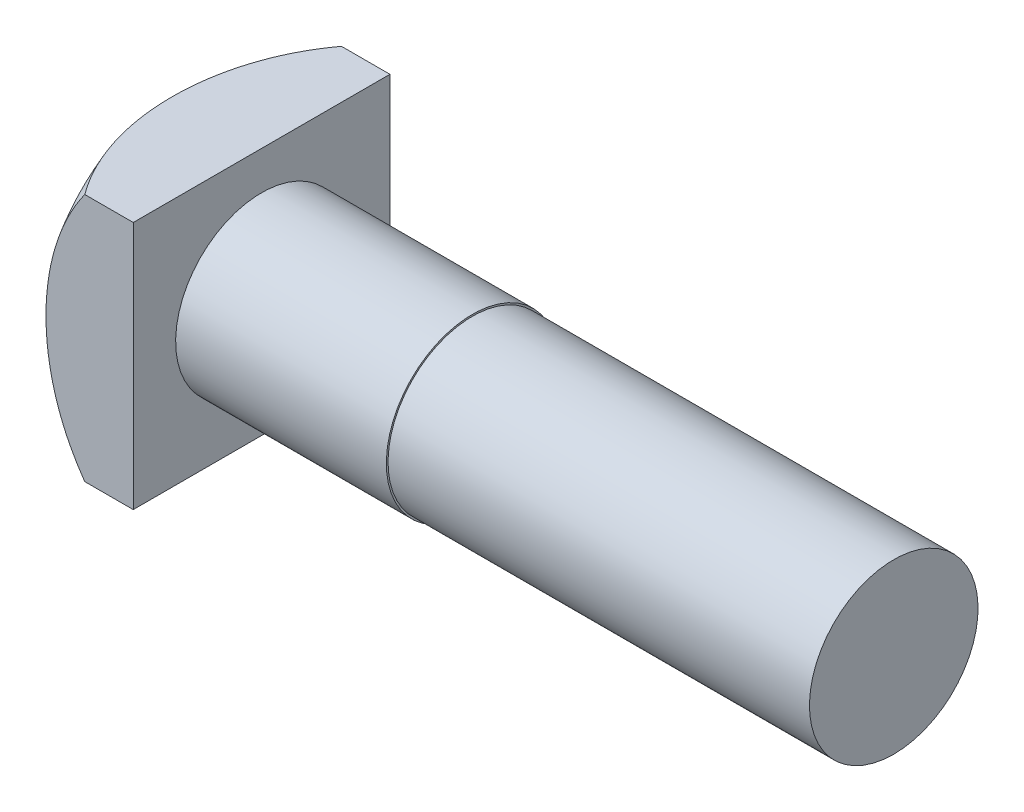
from build123d import *

# Parameters (mm, degrees)
SKETCH2_W      = 38.6744488
SKETCH2_H      = 37.46857502
EXTRUDE1_DEPTH = 16.6624


with BuildPart() as part:
    # Sketch1 → Revolve1 (revolve)
    with BuildSketch(Plane.XY, mode=Mode.PRIVATE) as revolve1_sk:
        Polygon((111.9124, 0), (16.6624, 0), (16.6624, 12.954), (48.4124, 12.954), (48.4124, 12.7), (111.9124, 12.7), align=None)
    revolve(revolve1_sk.sketch.rotate(Axis((0, 0, 0), (1, 0, 0)), 180), axis=Axis((0, 0, 0), (1, 0, 0)))

    # Sketch2 → Extrude1 (add)
    with BuildSketch(Plane(origin=(0, 0, 0), x_dir=(0, 0, -1), z_dir=(1, 0, 0))):
        Rectangle(SKETCH2_W, SKETCH2_H)
    extrude(amount=EXTRUDE1_DEPTH)

    # Sketch3 → Cut-Revolve1 (revolve, cut)
    with BuildSketch(Plane.XY, mode=Mode.PRIVATE) as cut_revolve1_sk:
        with BuildLine():
            Line((0, 0), (0, 10.258215468))
            ThreePointArc((0, 10.258215468), (5.469928088, 22.402987857), (15.210208347, 31.488280924))
            Line((15.210208347, 31.488280924), (-5.301244899, 31.488280924))
            Line((-5.301244899, 31.488280924), (-5.301244899, 0))
            Line((-5.301244899, 0), (0, 0))
        make_face()
    revolve(cut_revolve1_sk.sketch.rotate(Axis((0, 0, 0), (-1, 0, 0)), 90), axis=Axis((0, 0, 0), (-1, 0, 0)), mode=Mode.SUBTRACT)


solid = part.part
